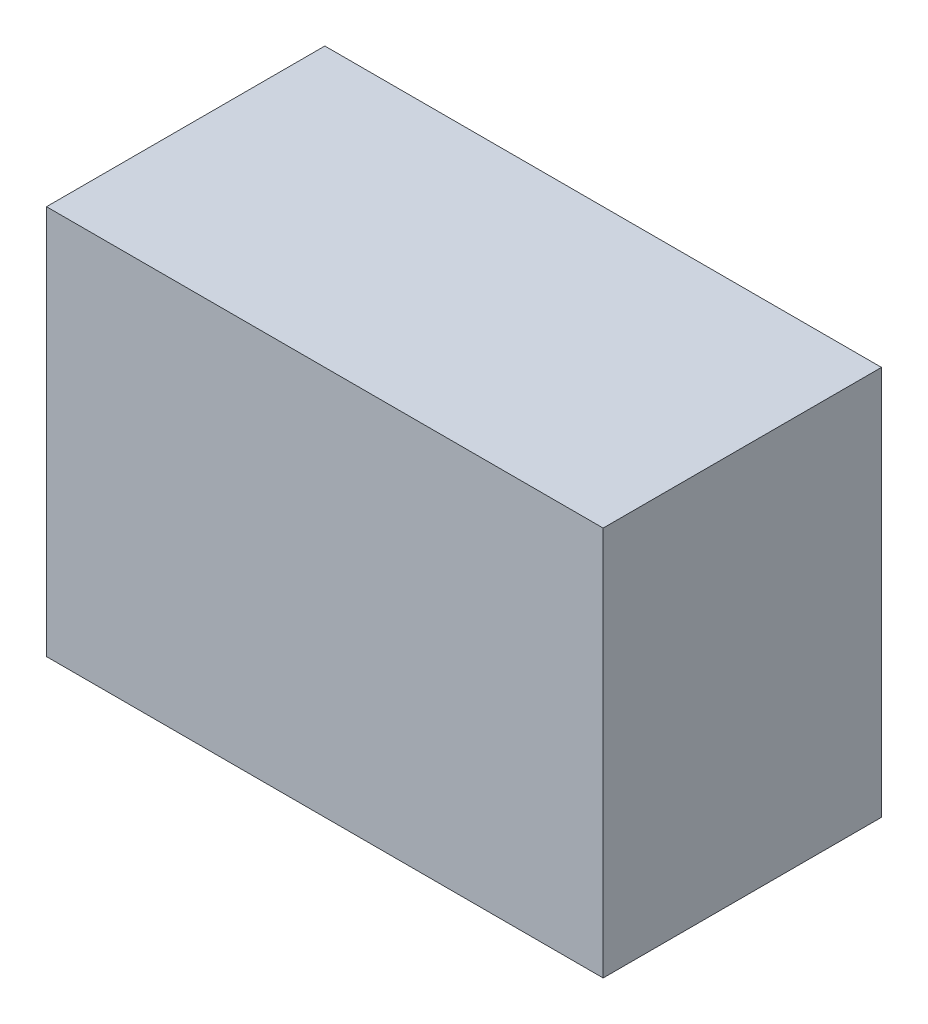
from build123d import *

# Parameters (mm, degrees)
SKETCH_1_W      = 100
SKETCH_1_H      = 70
EXTRUDE_1_DEPTH = 50


with BuildPart() as part:
    # 草图1 → 凸台-拉伸1 (new body)
    with BuildSketch(Plane.XY):
        Rectangle(SKETCH_1_W, SKETCH_1_H)
    extrude(amount=EXTRUDE_1_DEPTH)


solid = part.part
